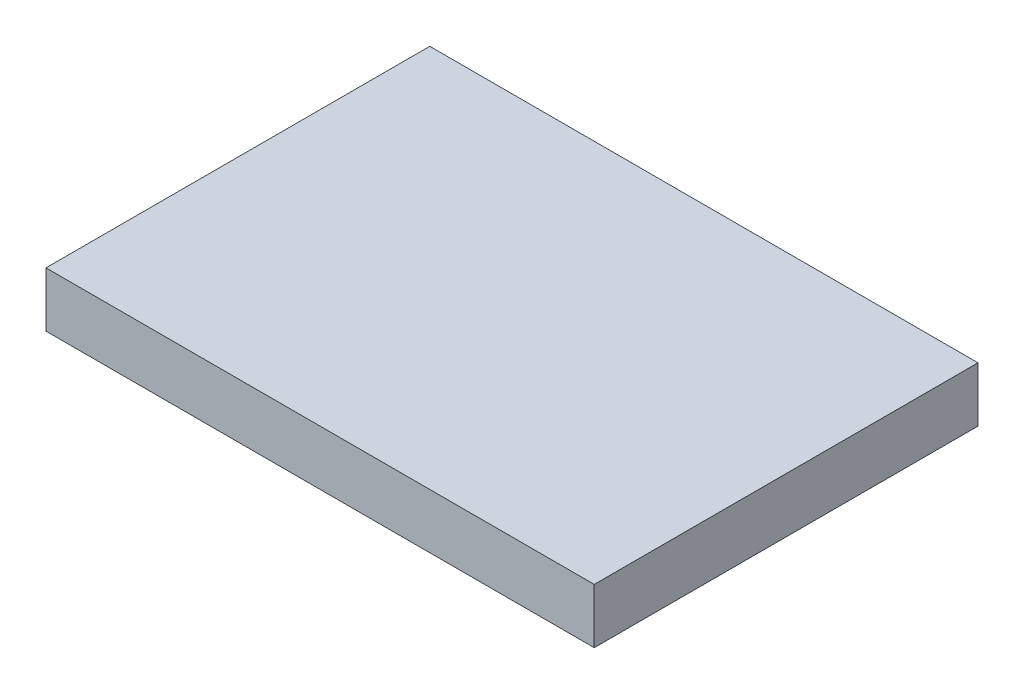
from build123d import *

# Parameters (mm, degrees)
SKETCH1_W           = 200
SKETCH1_H           = 140
BOSS_EXTRUDE1_DEPTH = 20


with BuildPart() as part:
    # Sketch1 → Boss-Extrude1 (new body)
    with BuildSketch(Plane(origin=(0, 0, 0), x_dir=(1, 0, 0), z_dir=(0, 1, 0))):
        Rectangle(SKETCH1_W, SKETCH1_H)
    extrude(amount=BOSS_EXTRUDE1_DEPTH)


solid = part.part
